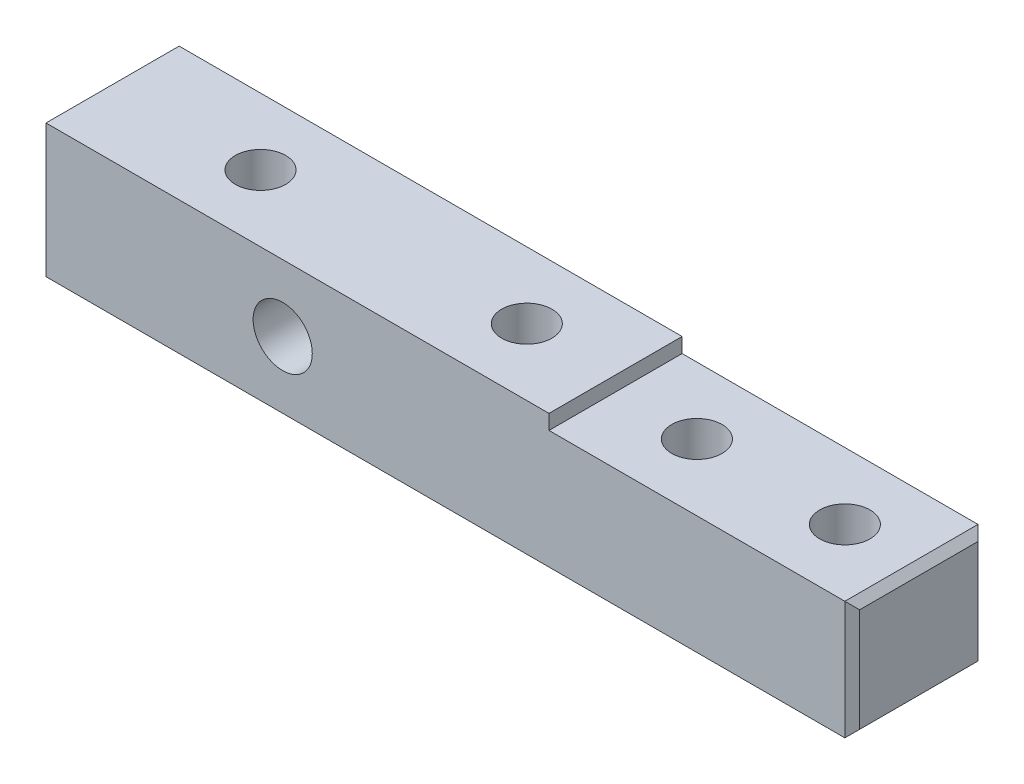
from build123d import *

# Parameters (mm, degrees)
SKETCH1_W                = 110
SKETCH1_H                = 18
BOSS_EXTRUDE1_DEPTH      = 9
SKETCH2_W                = 41
SKETCH2_H                = 2
CUT_EXTRUDE1_DEPTH       = 112.825757319
F_8_0_8_DIAMETER_HOLE1_D = 8
M8_TAPPED_HOLE1_D        = 6.8
CHAMFER1_SIZE            = 1


with BuildPart() as part:
    # Sketch1 → Boss-Extrude1 (new, symmetric)
    with BuildSketch(Plane.XY):
        with Locations((55, 0)):
            Rectangle(SKETCH1_W, SKETCH1_H)
    extrude(amount=BOSS_EXTRUDE1_DEPTH, both=True)

    # Sketch2 → Cut-Extrude1 (cut, through all)
    with BuildSketch(Plane.XY.offset(9)):
        with Locations((89.5, 8)):
            Rectangle(SKETCH2_W, SKETCH2_H)
    extrude(amount=-CUT_EXTRUDE1_DEPTH, mode=Mode.SUBTRACT)

    # Ø8.0 (8) Diameter Hole1 (through all)
    with Locations(Plane.XY.offset(9)):
        with Locations((33, 0)):
            Hole(F_8_0_8_DIAMETER_HOLE1_D / 2)

    # M8 Tapped Hole1 (through all)
    with Locations(Plane(origin=(0, 9, 0), x_dir=(1, 0, 0), z_dir=(0, 1, 0))):
        with Locations((21, 0), (57, 0), (80, 0), (100, 0)):
            Hole(M8_TAPPED_HOLE1_D / 2)

    # Chamfer1
    chamfer1_edges = [part.edges().sort_by_distance(p)[0] for p in [
        (110, -1, 9),
        (110, 7, 0),
        (0, 0, 9),
        (110, -1, -9),
        (0, 0, -9),
        (0, 9, 0),
        (110, -9, 0),
        (0, -9, 0),
    ]]
    chamfer(chamfer1_edges, length=CHAMFER1_SIZE)


solid = part.part
